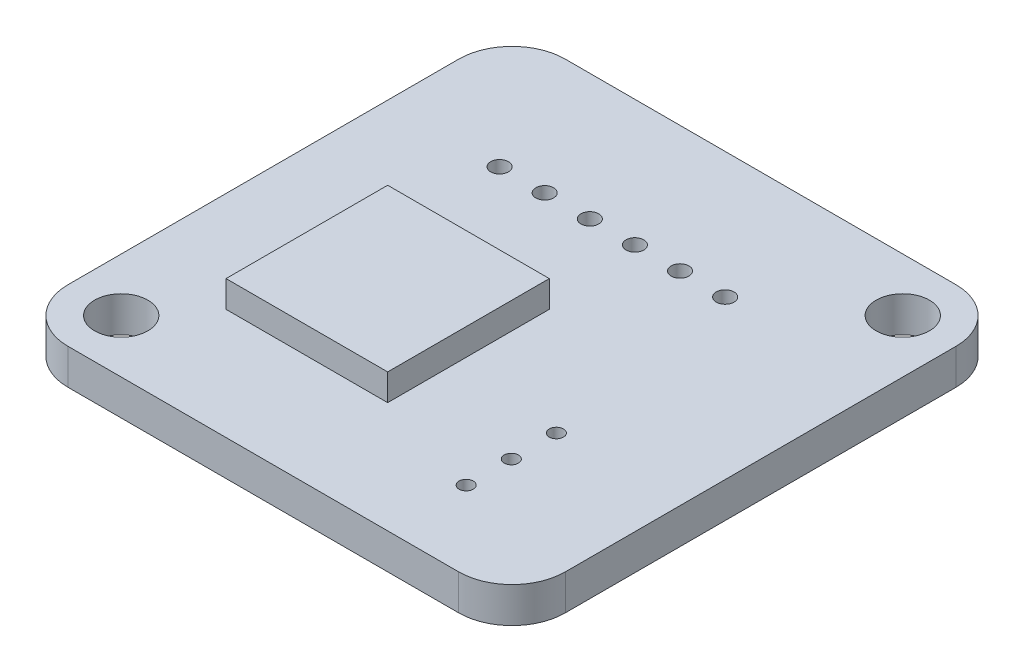
from build123d import *

# Parameters (mm, degrees)
ESQUISSE2_R             = 1.5
BOSS_EXTRU_1_DEPTH      = 2
ENL_V_MAT_EXTRU_1_REACH = 37.412
ESQUISSE3_R             = 0.5
ESQUISSE4_W             = 9.1
ESQUISSE4_H             = 9.1
BOSS_EXTRU_2_DEPTH      = 1.5
ENL_V_MAT_EXTRU_2_REACH = 37.412
ESQUISSE5_R             = 0.4


with BuildPart() as part:
    # Esquisse2 → Boss.-Extru.1 (new body)
    with BuildSketch(Plane(origin=(0, 0, 0), x_dir=(1, 0, 0), z_dir=(0, 1, 0))):
        with BuildLine():
            Line((0, -3), (22, -3))
            ThreePointArc((22, -3), (24.121320344, -2.121320344), (25, 0))
            Line((25, 0), (25, 22))
            ThreePointArc((25, 22), (24.121320344, 24.121320344), (22, 25))
            Line((22, 25), (0, 25))
            ThreePointArc((0, 25), (-2.121320344, 24.121320344), (-3, 22))
            Line((-3, 22), (-3, 0))
            ThreePointArc((-3, 0), (-2.121320344, -2.121320344), (0, -3))
        make_face()
        with Locations(Location((0, 0, 0), (0, 0, 270))):
            Circle(ESQUISSE2_R, mode=Mode.SUBTRACT)
        with Locations(Location((22, 22, 0), (0, 0, 270))):
            Circle(ESQUISSE2_R, mode=Mode.SUBTRACT)
    extrude(amount=BOSS_EXTRU_1_DEPTH)

    # Esquisse3 → Enlèv. mat.-Extru.1 (cut, up to next)
    with BuildSketch(Plane(origin=(0, 2, 0), x_dir=(1, 0, 0), z_dir=(0, 1, 0)), mode=Mode.PRIVATE) as enl_v_mat_extru_1_sk1:
        with Locations(Location((5.94, 17.9, 0), (0, 0, 270))):
            Circle(ESQUISSE3_R)
    enl_v_mat_extru_1_tool1 = extrude(enl_v_mat_extru_1_sk1.sketch, amount=-ENL_V_MAT_EXTRU_1_REACH, mode=Mode.PRIVATE) & part.part
    # Esquisse3 → Enlèv. mat.-Extru.1 (cut, up to next)
    with BuildSketch(Plane(origin=(0, 2, 0), x_dir=(1, 0, 0), z_dir=(0, 1, 0)), mode=Mode.PRIVATE) as enl_v_mat_extru_1_sk2:
        with Locations(Location((8.48, 17.9, 0), (0, 0, 270))):
            Circle(ESQUISSE3_R)
    enl_v_mat_extru_1_tool2 = extrude(enl_v_mat_extru_1_sk2.sketch, amount=-ENL_V_MAT_EXTRU_1_REACH, mode=Mode.PRIVATE) & part.part
    # Esquisse3 → Enlèv. mat.-Extru.1 (cut, up to next)
    with BuildSketch(Plane(origin=(0, 2, 0), x_dir=(1, 0, 0), z_dir=(0, 1, 0)), mode=Mode.PRIVATE) as enl_v_mat_extru_1_sk3:
        with Locations(Location((11.02, 17.9, 0), (0, 0, 270))):
            Circle(ESQUISSE3_R)
    enl_v_mat_extru_1_tool3 = extrude(enl_v_mat_extru_1_sk3.sketch, amount=-ENL_V_MAT_EXTRU_1_REACH, mode=Mode.PRIVATE) & part.part
    # Esquisse3 → Enlèv. mat.-Extru.1 (cut, up to next)
    with BuildSketch(Plane(origin=(0, 2, 0), x_dir=(1, 0, 0), z_dir=(0, 1, 0)), mode=Mode.PRIVATE) as enl_v_mat_extru_1_sk4:
        with Locations(Location((13.56, 17.9, 0), (0, 0, 270))):
            Circle(ESQUISSE3_R)
    enl_v_mat_extru_1_tool4 = extrude(enl_v_mat_extru_1_sk4.sketch, amount=-ENL_V_MAT_EXTRU_1_REACH, mode=Mode.PRIVATE) & part.part
    # Esquisse3 → Enlèv. mat.-Extru.1 (cut, up to next)
    with BuildSketch(Plane(origin=(0, 2, 0), x_dir=(1, 0, 0), z_dir=(0, 1, 0)), mode=Mode.PRIVATE) as enl_v_mat_extru_1_sk5:
        with Locations(Location((16.1, 17.9, 0), (0, 0, 270))):
            Circle(ESQUISSE3_R)
    enl_v_mat_extru_1_tool5 = extrude(enl_v_mat_extru_1_sk5.sketch, amount=-ENL_V_MAT_EXTRU_1_REACH, mode=Mode.PRIVATE) & part.part
    # Esquisse3 → Enlèv. mat.-Extru.1 (cut, up to next)
    with BuildSketch(Plane(origin=(0, 2, 0), x_dir=(1, 0, 0), z_dir=(0, 1, 0)), mode=Mode.PRIVATE) as enl_v_mat_extru_1_sk6:
        with Locations(Location((3.4, 17.9, 0), (0, 0, 270))):
            Circle(ESQUISSE3_R)
    enl_v_mat_extru_1_tool6 = extrude(enl_v_mat_extru_1_sk6.sketch, amount=-ENL_V_MAT_EXTRU_1_REACH, mode=Mode.PRIVATE) & part.part
    add(enl_v_mat_extru_1_tool1.solids().sort_by_distance((5.94, 2, -17.9))[0], mode=Mode.SUBTRACT)
    add(enl_v_mat_extru_1_tool2.solids().sort_by_distance((8.48, 2, -17.9))[0], mode=Mode.SUBTRACT)
    add(enl_v_mat_extru_1_tool3.solids().sort_by_distance((11.02, 2, -17.9))[0], mode=Mode.SUBTRACT)
    add(enl_v_mat_extru_1_tool4.solids().sort_by_distance((13.56, 2, -17.9))[0], mode=Mode.SUBTRACT)
    add(enl_v_mat_extru_1_tool5.solids().sort_by_distance((16.1, 2, -17.9))[0], mode=Mode.SUBTRACT)
    add(enl_v_mat_extru_1_tool6.solids().sort_by_distance((3.4, 2, -17.9))[0], mode=Mode.SUBTRACT)

    # Esquisse4 → Boss.-Extru.2 (add)
    with BuildSketch(Plane(origin=(0, 2, 0), x_dir=(1, 0, 0), z_dir=(0, 1, 0))):
        with Locations((7.2, 7.8)):
            Rectangle(ESQUISSE4_W, ESQUISSE4_H)
    extrude(amount=BOSS_EXTRU_2_DEPTH)

    # Esquisse5 → Enlèv. mat.-Extru.2 (cut, up to next)
    with BuildSketch(Plane(origin=(0, 2, 0), x_dir=(1, 0, 0), z_dir=(0, 1, 0)), mode=Mode.PRIVATE) as enl_v_mat_extru_2_sk1:
        with Locations(Location((17.98, 1.44, 0), (0, 0, 270))):
            Circle(ESQUISSE5_R)
    enl_v_mat_extru_2_tool1 = extrude(enl_v_mat_extru_2_sk1.sketch, amount=-ENL_V_MAT_EXTRU_2_REACH, mode=Mode.PRIVATE) & part.part
    # Esquisse5 → Enlèv. mat.-Extru.2 (cut, up to next)
    with BuildSketch(Plane(origin=(0, 2, 0), x_dir=(1, 0, 0), z_dir=(0, 1, 0)), mode=Mode.PRIVATE) as enl_v_mat_extru_2_sk2:
        with Locations(Location((17.98, 3.98, 0), (0, 0, 270))):
            Circle(ESQUISSE5_R)
    enl_v_mat_extru_2_tool2 = extrude(enl_v_mat_extru_2_sk2.sketch, amount=-ENL_V_MAT_EXTRU_2_REACH, mode=Mode.PRIVATE) & part.part
    # Esquisse5 → Enlèv. mat.-Extru.2 (cut, up to next)
    with BuildSketch(Plane(origin=(0, 2, 0), x_dir=(1, 0, 0), z_dir=(0, 1, 0)), mode=Mode.PRIVATE) as enl_v_mat_extru_2_sk3:
        with Locations(Location((17.98, 6.52, 0), (0, 0, 270))):
            Circle(ESQUISSE5_R)
    enl_v_mat_extru_2_tool3 = extrude(enl_v_mat_extru_2_sk3.sketch, amount=-ENL_V_MAT_EXTRU_2_REACH, mode=Mode.PRIVATE) & part.part
    add(enl_v_mat_extru_2_tool1.solids().sort_by_distance((17.98, 2, -1.44))[0], mode=Mode.SUBTRACT)
    add(enl_v_mat_extru_2_tool2.solids().sort_by_distance((17.98, 2, -3.98))[0], mode=Mode.SUBTRACT)
    add(enl_v_mat_extru_2_tool3.solids().sort_by_distance((17.98, 2, -6.52))[0], mode=Mode.SUBTRACT)


solid = part.part
